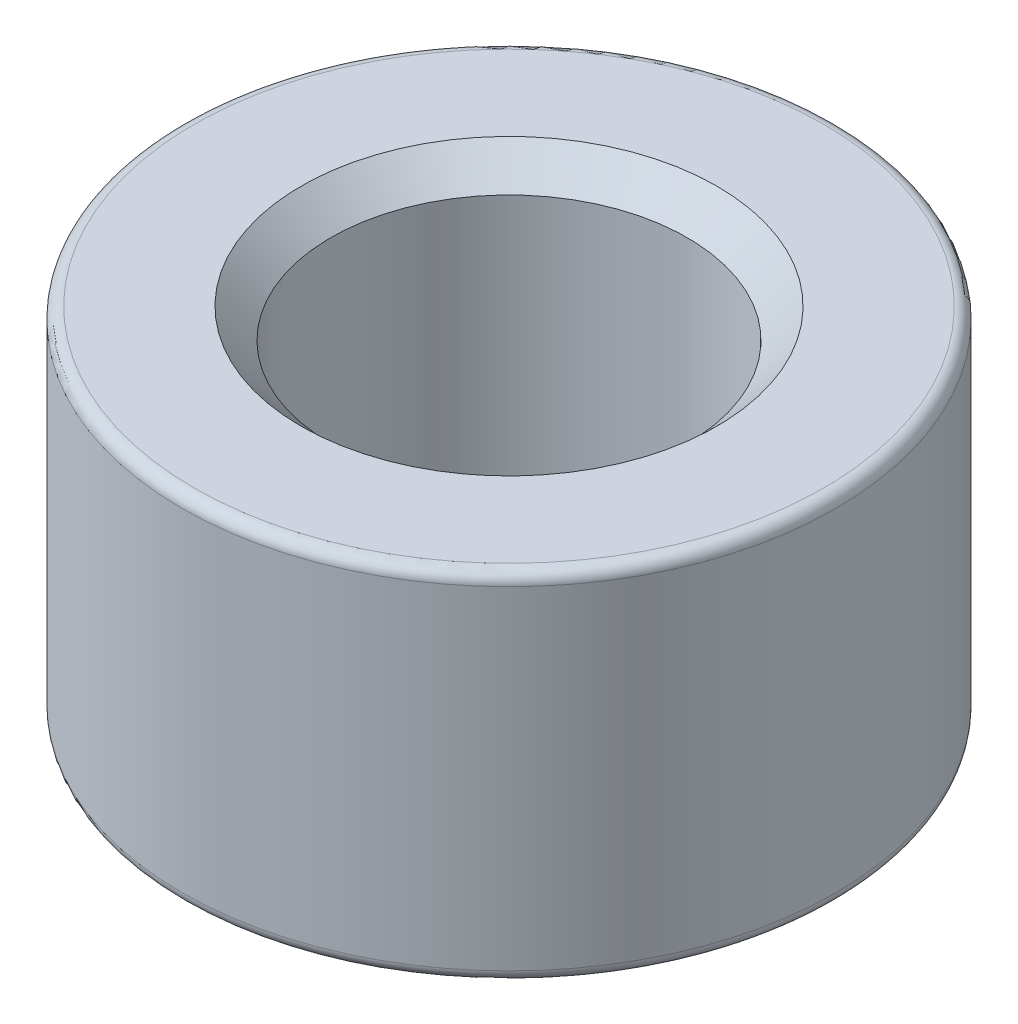
from build123d import *

# Parameters (mm, degrees)
SKETCH1_R           = 2.75
SKETCH1_R_2         = 1.5
BOSS_EXTRUDE1_DEPTH = 1.5
CHAMFER1_SIZE       = 0.25
FILLET1_R           = 0.1


with BuildPart() as part:
    # Sketch1 → Boss-Extrude1 (new, symmetric)
    with BuildSketch(Plane(origin=(0, 0, 0), x_dir=(1, 0, 0), z_dir=(0, 1, 0))):
        with Locations(Location((0, 0, 0), (0, 0, 270))):
            Circle(SKETCH1_R)
        with Locations(Location((0, 0, 0), (0, 0, 270))):
            Circle(SKETCH1_R_2, mode=Mode.SUBTRACT)
    extrude(amount=BOSS_EXTRUDE1_DEPTH, both=True)

    # Chamfer1
    chamfer1_edges = [part.edges().sort_by_distance(p)[0] for p in [
        (0, -1.5, -1.5),
        (0, 1.5, -1.5),
    ]]
    chamfer(chamfer1_edges, length=CHAMFER1_SIZE)

    # Fillet1
    fillet1_edges = [part.edges().sort_by_distance(p)[0] for p in [
        (0, -1.5, -2.75),
        (0, 1.5, -2.75),
    ]]
    fillet(fillet1_edges, radius=FILLET1_R)


solid = part.part
